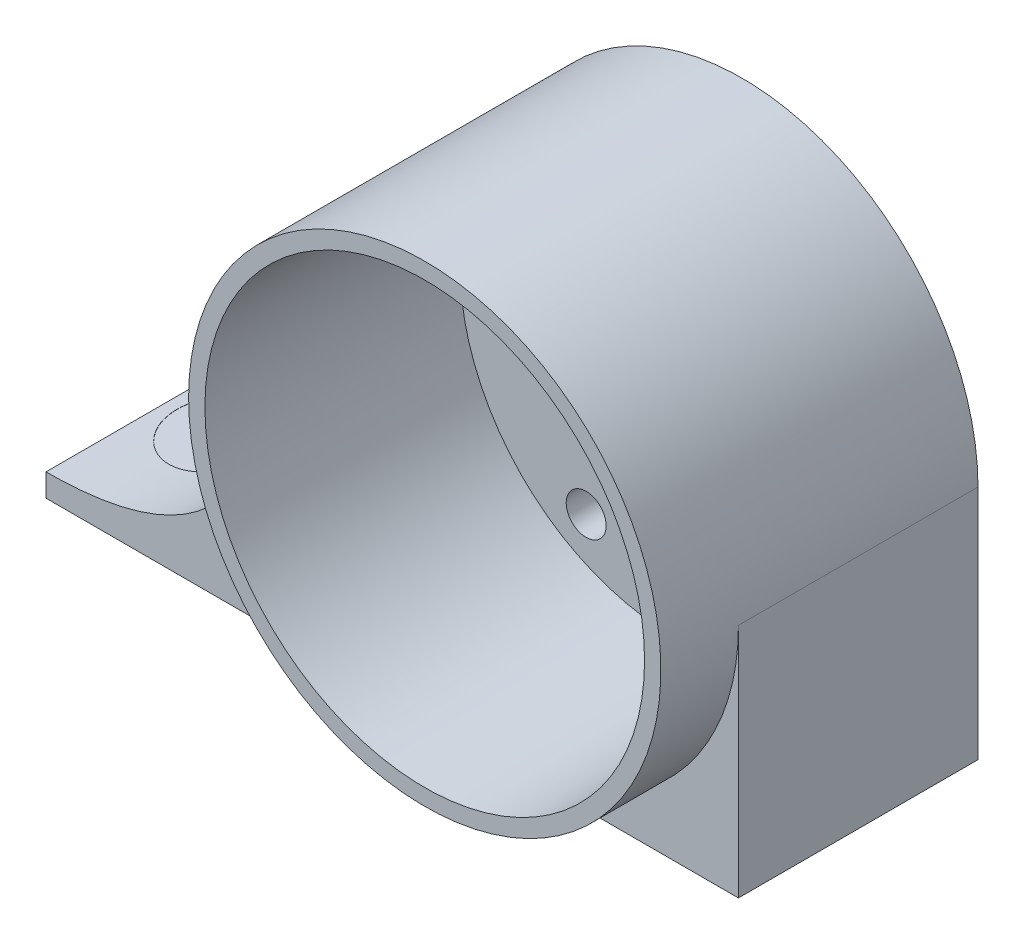
from build123d import *

# Parameters (mm, degrees)
SKIZZE1_R                       = 18.7
SKIZZE1_R_2                     = 6.1
SKIZZE1_R_3                     = 1.75
AUFSATZ_LINEAR_AUSTRAGEN1_DEPTH = 6
SKIZZE3_R                       = 20.7
SKIZZE3_R_2                     = 18.7
AUFSATZ_LINEAR_AUSTRAGEN2_DEPTH = 27.8
AUFSATZ_LINEAR_AUSTRAGEN3_DEPTH = 21
SKIZZE7_R                       = 2.25
SCHNITT_LINEAR_AUSTRAGEN1_DEPTH = 64.928084722
SKIZZE8_R                       = 5
SCHNITT_LINEAR_AUSTRAGEN2_DEPTH = 10.5
FORMSCHR_GE1_ANGLE              = 1.5
SKIZZE9_R                       = 2.774707021
SKIZZE9_R_2                     = 1.75
SCHNITT_LINEAR_AUSTRAGEN3_DEPTH = 1.5
SKIZZE10_W                      = 19.3
SKIZZE10_H                      = 20.7
SCHNITT_LINEAR_AUSTRAGEN4_DEPTH = 50.69396358


with BuildPart() as part:
    # Skizze1 → Aufsatz-Linear austragen1 (new body)
    with BuildSketch(Plane.XY):
        Circle(SKIZZE1_R)
        with Locations((0, -7)):
            Circle(SKIZZE1_R_2, mode=Mode.SUBTRACT)
        with Locations((-7.65, 13.250188678)):
            Circle(SKIZZE1_R_3, mode=Mode.SUBTRACT)
        with Locations((7.65, 13.250188678)):
            Circle(SKIZZE1_R_3, mode=Mode.SUBTRACT)
        with Locations((-15.3, 0)):
            Circle(SKIZZE1_R_3, mode=Mode.SUBTRACT)
        with Locations((15.3, 0)):
            Circle(SKIZZE1_R_3, mode=Mode.SUBTRACT)
        with Locations((-7.65, -13.250188678)):
            Circle(SKIZZE1_R_3, mode=Mode.SUBTRACT)
        with Locations((7.65, -13.250188678)):
            Circle(SKIZZE1_R_3, mode=Mode.SUBTRACT)
    extrude(amount=AUFSATZ_LINEAR_AUSTRAGEN1_DEPTH)

    # Skizze3 → Aufsatz-Linear austragen2 (add)
    with BuildSketch(Plane(origin=(0, 0, 0), x_dir=(-1, 0, 0), z_dir=(0, 0, -1))):
        Circle(SKIZZE3_R)
        Circle(SKIZZE3_R_2, mode=Mode.SUBTRACT)
    extrude(amount=-AUFSATZ_LINEAR_AUSTRAGEN2_DEPTH)

    # Skizze4 → Aufsatz-Linear austragen3 (add)
    with BuildSketch(Plane(origin=(0, 0, 0), x_dir=(-1, 0, 0), z_dir=(0, 0, -1))):
        with BuildLine():
            add(Edge.make_bspline(
                [(-20.7, 0), (-20.7, -18.7), (-40, -18.7)],
                knots=[0, 0, 0, 1, 1, 1], degree=2))
            Line((-40, -18.7), (-40, -20.7))
            Line((-40, -20.7), (9.3e-08, -20.7))
            ThreePointArc((9.3e-08, -20.7), (-14.637110338, -14.637110404), (-20.7, 0))
        make_face()
        with BuildLine():
            ThreePointArc((20.7, 0), (14.637110404, -14.637110338), (9.3e-08, -20.7))
            Line((9.3e-08, -20.7), (40, -20.7))
            Line((40, -20.7), (40, -18.7))
            add(Edge.make_bspline(
                [(20.7, 0), (20.7, -18.7), (40, -18.7)],
                knots=[0, 0, 0, 1, 1, 1], degree=2))
        make_face()
    extrude(amount=-AUFSATZ_LINEAR_AUSTRAGEN3_DEPTH)

    # Skizze7 → Schnitt-Linear austragen1 (cut, through all)
    with BuildSketch(Plane.XZ.offset(20.7)):
        with Locations((-34, 10.5)):
            Circle(SKIZZE7_R)
        with Locations((34, 10.5)):
            Circle(SKIZZE7_R)
    extrude(amount=-SCHNITT_LINEAR_AUSTRAGEN1_DEPTH, mode=Mode.SUBTRACT)

    # Skizze8 → Schnitt-Linear austragen2 (cut)
    with BuildSketch(Plane.XZ.offset(18.7)):
        with Locations((-34, 10.5)):
            Circle(SKIZZE8_R)
        with Locations((34, 10.5)):
            Circle(SKIZZE8_R)
    extrude(amount=-SCHNITT_LINEAR_AUSTRAGEN2_DEPTH, mode=Mode.SUBTRACT)

    # Formschräge1
    formschr_ge1_faces = [part.faces().sort_by_distance(p)[0] for p in [
        (18.7, 0, 16.9),
    ]]
    draft(formschr_ge1_faces, Plane.XY.offset(6), FORMSCHR_GE1_ANGLE)

    # Skizze9 → Schnitt-Linear austragen3 (cut)
    # profile 1 of 6: a face of its own
    with BuildSketch(Plane(origin=(0, 0, 0), x_dir=(-1, 0, 0), z_dir=(0, 0, -1))):
        with Locations((-7.65, 13.250188678)):
            Circle(SKIZZE9_R)
        with Locations((-7.65, 13.250188678)):
            Circle(SKIZZE9_R_2, mode=Mode.SUBTRACT)
    # profile 2 of 6: a face of its own
    with BuildSketch(Plane(origin=(0, 0, 0), x_dir=(-1, 0, 0), z_dir=(0, 0, -1))):
        with Locations((7.65, 13.250188678)):
            Circle(SKIZZE9_R)
        with Locations((7.65, 13.250188678)):
            Circle(SKIZZE9_R_2, mode=Mode.SUBTRACT)
    # profile 3 of 6: a face of its own
    with BuildSketch(Plane(origin=(0, 0, 0), x_dir=(-1, 0, 0), z_dir=(0, 0, -1))):
        with Locations((-15.3, 0)):
            Circle(SKIZZE9_R)
        with Locations((-15.3, 0)):
            Circle(SKIZZE9_R_2, mode=Mode.SUBTRACT)
    # profile 4 of 6: a face of its own
    with BuildSketch(Plane(origin=(0, 0, 0), x_dir=(-1, 0, 0), z_dir=(0, 0, -1))):
        with Locations((15.3, 0)):
            Circle(SKIZZE9_R)
        with Locations((15.3, 0)):
            Circle(SKIZZE9_R_2, mode=Mode.SUBTRACT)
    # profile 5 of 6: a face of its own
    with BuildSketch(Plane(origin=(0, 0, 0), x_dir=(-1, 0, 0), z_dir=(0, 0, -1))):
        with Locations((7.65, -13.250188678)):
            Circle(SKIZZE9_R)
        with Locations((7.65, -13.250188678)):
            Circle(SKIZZE9_R_2, mode=Mode.SUBTRACT)
    # profile 6 of 6: a face of its own
    with BuildSketch(Plane(origin=(0, 0, 0), x_dir=(-1, 0, 0), z_dir=(0, 0, -1))):
        with Locations((-7.65, -13.250188678)):
            Circle(SKIZZE9_R)
        with Locations((-7.65, -13.250188678)):
            Circle(SKIZZE9_R_2, mode=Mode.SUBTRACT)
    extrude(amount=-SCHNITT_LINEAR_AUSTRAGEN3_DEPTH, mode=Mode.SUBTRACT)

    # Skizze10 → Schnitt-Linear austragen4 (cut, through all)
    with BuildSketch(Plane.XY.offset(21)):
        with Locations((30.35, -10.35)):
            Rectangle(SKIZZE10_W, SKIZZE10_H)
    extrude(amount=-SCHNITT_LINEAR_AUSTRAGEN4_DEPTH, mode=Mode.SUBTRACT)


solid = part.part
